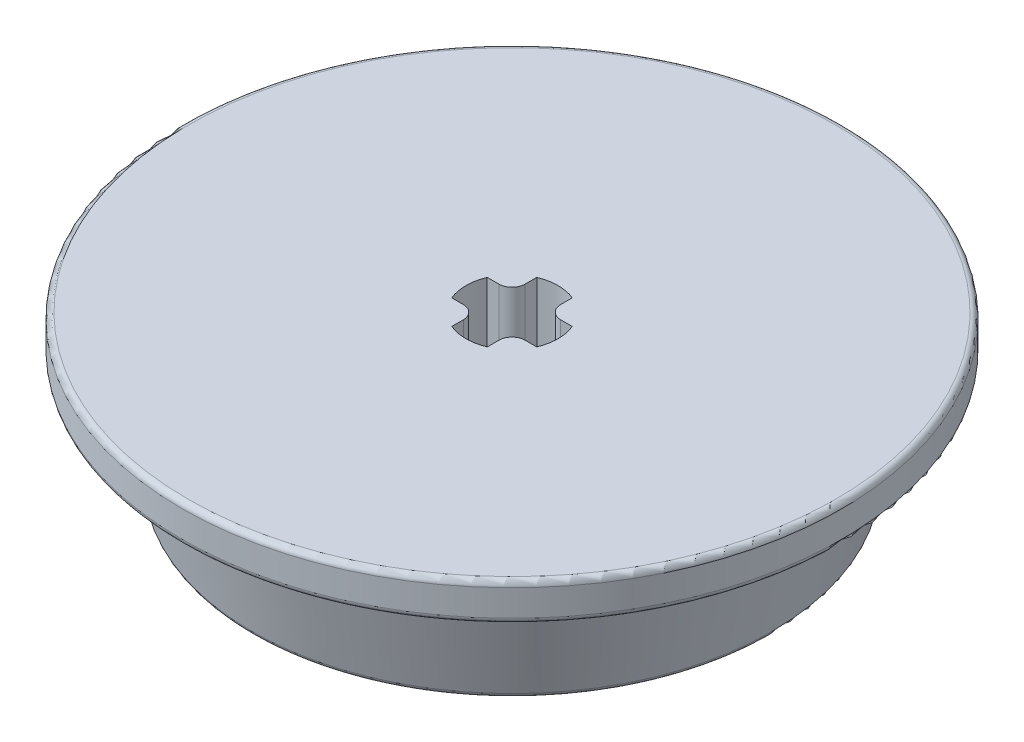
from build123d import *

# Parameters (mm, degrees)
CUT_EXTRUDE1_DEPTH = 26.956426849
FILLET1_R          = 0.7
FILLET2_R          = 0.3


with BuildPart() as part:
    # Sketch2 → Revolve1 (revolve)
    with BuildSketch(Plane.XY, mode=Mode.PRIVATE) as revolve1_sk:
        Polygon((0, 0), (17.460470996, 0), (17.460470996, -2), (15, -2), (13.72466063, -8), (0, -8), align=None)
    revolve(revolve1_sk.sketch.rotate(Axis((0, 0, 0), (0, 1, 0)), 90), axis=Axis((0, 0, 0), (0, 1, 0)))

    # Sketch1 → Cut-Extrude1 (cut, through all)
    with BuildSketch(Plane(origin=(0, 0, 0), x_dir=(1, 0, 0), z_dir=(0, 1, 0))):
        with BuildLine():
            Line((-0.94, 0.94), (-2.25166605, 0.94))
            ThreePointArc((-2.25166605, 0.94), (-2.44, 0), (-2.25166605, -0.94))
            Line((-2.25166605, -0.94), (-0.94, -0.94))
            Line((-0.94, -0.94), (-0.94, -2.25166605))
            ThreePointArc((-0.94, -2.25166605), (0, -2.44), (0.94, -2.25166605))
            Line((0.94, -2.25166605), (0.94, -0.94))
            Line((0.94, -0.94), (2.25166605, -0.94))
            ThreePointArc((2.25166605, -0.94), (2.44, 0), (2.25166605, 0.94))
            Line((2.25166605, 0.94), (0.94, 0.94))
            Line((0.94, 0.94), (0.94, 2.25166605))
            ThreePointArc((0.94, 2.25166605), (0, 2.44), (-0.94, 2.25166605))
            Line((-0.94, 2.25166605), (-0.94, 0.94))
        make_face()
    extrude(amount=-CUT_EXTRUDE1_DEPTH, mode=Mode.SUBTRACT)

    # Fillet1
    fillet1_edges = [part.edges().sort_by_distance(p)[0] for p in [
        (-0.94, -4, -0.94),
        (0.94, -4, -0.94),
        (0.94, -4, 0.94),
        (-0.94, -4, 0.94),
    ]]
    fillet(fillet1_edges, radius=FILLET1_R)

    # Fillet2
    fillet2_edges = [part.edges().sort_by_distance(p)[0] for p in [
        (0, -8, 13.72466063),
        (0, -2, 15),
        (0, -2, 17.460470996),
        (0, 0, 17.460470996),
    ]]
    fillet(fillet2_edges, radius=FILLET2_R)


solid = part.part
